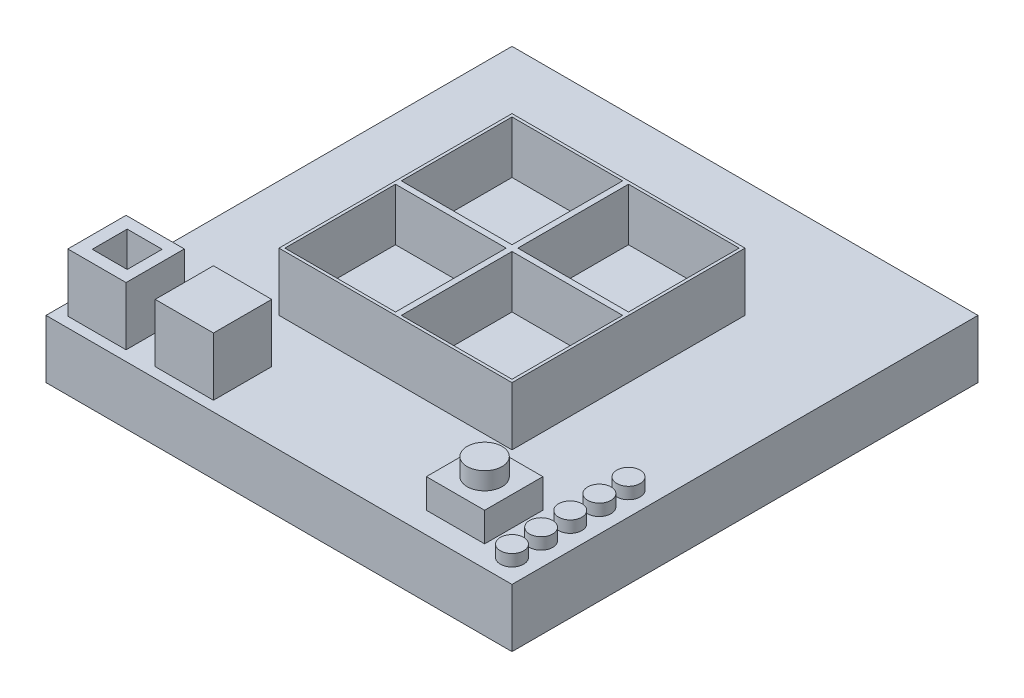
from build123d import *

# Parameters (mm, degrees)
SKETCH1_W           = 400
SKETCH1_H           = 400
BOSS_EXTRUDE1_DEPTH = 50
SKETCH3_W           = 200
SKETCH3_H           = 200
BOSS_EXTRUDE2_DEPTH = 50
SKETCH4_W           = 95
SKETCH4_H           = 95
CUT_EXTRUDE1_DEPTH  = 45
SKETCH6_R           = 10
BOSS_EXTRUDE4_DEPTH = 10
LPATTERN3_COUNT     = 5
LPATTERN3_PITCH     = 25
SKETCH7_W           = 50
SKETCH7_H           = 50
BOSS_EXTRUDE5_DEPTH = 25
SKETCH8_R           = 15
BOSS_EXTRUDE6_DEPTH = 15
SKETCH10_W          = 50
SKETCH10_H          = 50
BOSS_EXTRUDE7_DEPTH = 50
SKETCH12_W          = 30
SKETCH12_H          = 30
CUT_EXTRUDE2_DEPTH  = 45
SKETCH13_W          = 50
SKETCH13_H          = 50
BOSS_EXTRUDE8_DEPTH = 50


with BuildPart() as part:
    # Sketch1 → Boss-Extrude1 (new body)
    with BuildSketch(Plane(origin=(0, 0, 0), x_dir=(1, 0, 0), z_dir=(0, 1, 0))):
        Rectangle(SKETCH1_W, SKETCH1_H)
    extrude(amount=BOSS_EXTRUDE1_DEPTH)

    # Sketch3 → Boss-Extrude2 (add)
    with BuildSketch(Plane(origin=(0, 50, 0), x_dir=(1, 0, 0), z_dir=(0, 1, 0))):
        Rectangle(SKETCH3_W, SKETCH3_H)
    extrude(amount=BOSS_EXTRUDE2_DEPTH)

    # Sketch4 → Cut-Extrude1 (cut)
    with BuildSketch(Plane(origin=(0, 100, 0), x_dir=(1, 0, 0), z_dir=(0, 1, 0))):
        with Locations((-50, -50)):
            Rectangle(SKETCH4_W, SKETCH4_H)
        with Locations((50, -50)):
            Rectangle(SKETCH4_W, SKETCH4_H)
        with Locations((-50, 50)):
            Rectangle(SKETCH4_W, SKETCH4_H)
        with Locations((50, 50)):
            Rectangle(SKETCH4_W, SKETCH4_H)
    extrude(amount=-CUT_EXTRUDE1_DEPTH, mode=Mode.SUBTRACT)

    # Sketch6 → Boss-Extrude4 (add)
    with BuildSketch(Plane(origin=(0, 50, 0), x_dir=(1, 0, 0), z_dir=(0, 1, 0))):
        with Locations((180, -180)):
            Circle(SKETCH6_R)
    boss_extrude4 = extrude(amount=BOSS_EXTRUDE4_DEPTH)

    # LPattern3: Boss-Extrude4 ×5
    with Locations(*[(0, 0, -i * LPATTERN3_PITCH) for i in range(1, LPATTERN3_COUNT)]):
        add(boss_extrude4)

    # Sketch7 → Boss-Extrude5 (add)
    with BuildSketch(Plane(origin=(0, 50, 0), x_dir=(1, 0, 0), z_dir=(0, 1, 0))):
        with Locations((133.117890176, -156.630485574)):
            Rectangle(SKETCH7_W, SKETCH7_H)
    extrude(amount=BOSS_EXTRUDE5_DEPTH)

    # Sketch8 → Boss-Extrude6 (add)
    with BuildSketch(Plane(origin=(0, 75, 0), x_dir=(1, 0, 0), z_dir=(0, 1, 0))):
        with Locations((133.117890176, -156.630485574)):
            Circle(SKETCH8_R)
    extrude(amount=BOSS_EXTRUDE6_DEPTH)

    # Sketch10 → Boss-Extrude7 (add)
    with BuildSketch(Plane(origin=(0, 50, 0), x_dir=(1, 0, 0), z_dir=(0, 1, 0))):
        with Locations((-165.022837079, -166.245313822)):
            Rectangle(SKETCH10_W, SKETCH10_H)
    extrude(amount=BOSS_EXTRUDE7_DEPTH)

    # Sketch12 → Cut-Extrude2 (cut)
    with BuildSketch(Plane(origin=(0, 100, 0), x_dir=(1, 0, 0), z_dir=(0, 1, 0))):
        with Locations((-164.276921981, -166.025383847)):
            Rectangle(SKETCH12_W, SKETCH12_H)
    extrude(amount=-CUT_EXTRUDE2_DEPTH, mode=Mode.SUBTRACT)

    # Sketch13 → Boss-Extrude8 (add)
    with BuildSketch(Plane(origin=(0, 50, 0), x_dir=(1, 0, 0), z_dir=(0, 1, 0))):
        with Locations((-90.022837079, -166.245313822)):
            Rectangle(SKETCH13_W, SKETCH13_H)
    extrude(amount=BOSS_EXTRUDE8_DEPTH)


solid = part.part
